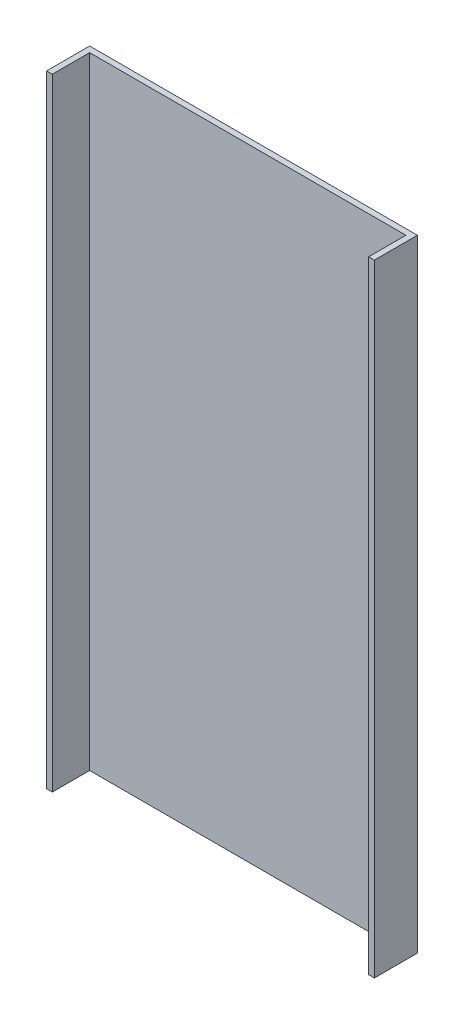
from build123d import *

# Parameters (mm, degrees)
SKETCH1_W           = 72.46
SKETCH1_H           = 137.44
BOSS_EXTRUDE1_DEPTH = 1.27
SKETCH2_W           = 1.27
SKETCH2_H           = 137.44
BOSS_EXTRUDE2_DEPTH = 8.25


with BuildPart() as part:
    # Sketch1 → Boss-Extrude1 (new body)
    with BuildSketch(Plane.XY):
        with Locations((36.23, 68.72)):
            Rectangle(SKETCH1_W, SKETCH1_H)
    extrude(amount=BOSS_EXTRUDE1_DEPTH)

    # Sketch2 → Boss-Extrude2 (add)
    with BuildSketch(Plane.XY.offset(1.27)):
        with Locations((0.635, 68.72)):
            Rectangle(SKETCH2_W, SKETCH2_H)
        with Locations((71.825, 68.72)):
            Rectangle(SKETCH2_W, SKETCH2_H)
    extrude(amount=BOSS_EXTRUDE2_DEPTH)


solid = part.part
